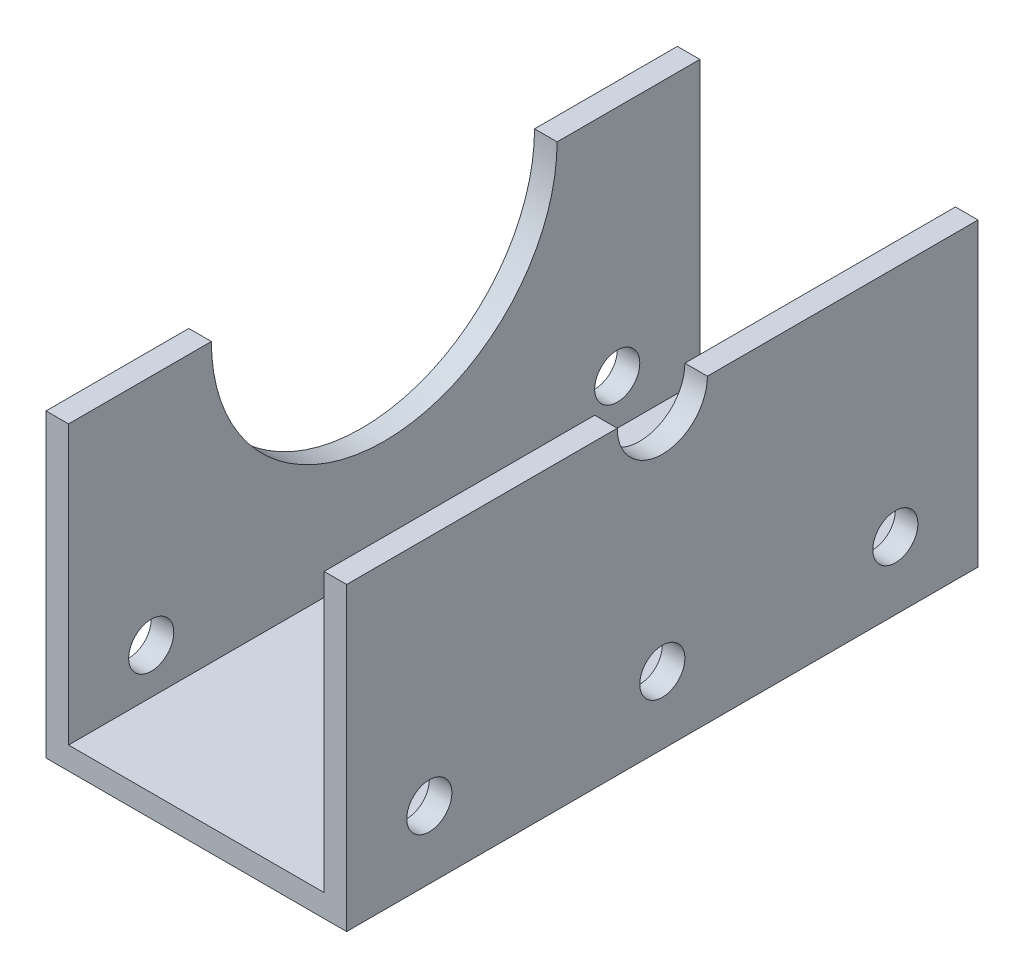
from build123d import *

# Parameters (mm, degrees)
EXTRUSION1_DEPTH = 42
ESQUISSE2_R      = 1.5
EXTRUSION2_DEPTH = 49.350239901
ESQUISSE3_R      = 1.5
EXTRUSION3_DEPTH = 10
ESQUISSE4_R      = 11.5
EXTRUSION4_DEPTH = 10
ESQUISSE5_R      = 3
EXTRUSION5_DEPTH = 10


with BuildPart() as part:
    # Esquisse1 → Extrusion1 (new body)
    with BuildSketch(Plane.XY):
        Polygon((-15.613581117, 13.181263158), (-15.613581117, -6.818736842), (4.386418883, -6.818736842), (4.386418883, 13.181263158), (2.886418883, 13.181263158), (2.886418883, -5.318736842), (-14.113581117, -5.318736842), (-14.113581117, 13.181263158), align=None)
    extrude(amount=EXTRUSION1_DEPTH)

    # Esquisse2 → Extrusion2 (cut, through all)
    with BuildSketch(Plane(origin=(4.386418883, 0, 0), x_dir=(0, 0, -1), z_dir=(1, 0, 0))):
        with Locations((-36.5, -2.318736842)):
            Circle(ESQUISSE2_R)
        with Locations((-5.5, -2.318736842)):
            Circle(ESQUISSE2_R)
    extrude(amount=-EXTRUSION2_DEPTH, mode=Mode.SUBTRACT)

    # Esquisse3 → Extrusion3 (cut)
    with BuildSketch(Plane(origin=(4.386418883, 0, 0), x_dir=(0, 0, -1), z_dir=(1, 0, 0))):
        with Locations((-21, -2.318736842)):
            Circle(ESQUISSE3_R)
    extrude(amount=-EXTRUSION3_DEPTH, mode=Mode.SUBTRACT)

    # Esquisse4 → Extrusion4 (cut)
    with BuildSketch(Plane.ZY.offset(15.613581117)):
        with Locations((21, 13.181263158)):
            Circle(ESQUISSE4_R)
    extrude(amount=-EXTRUSION4_DEPTH, mode=Mode.SUBTRACT)

    # Esquisse5 → Extrusion5 (cut)
    with BuildSketch(Plane(origin=(4.386418883, 0, 0), x_dir=(0, 0, -1), z_dir=(1, 0, 0))):
        with Locations((-21, 13.181263158)):
            Circle(ESQUISSE5_R)
    extrude(amount=-EXTRUSION5_DEPTH, mode=Mode.SUBTRACT)


solid = part.part
